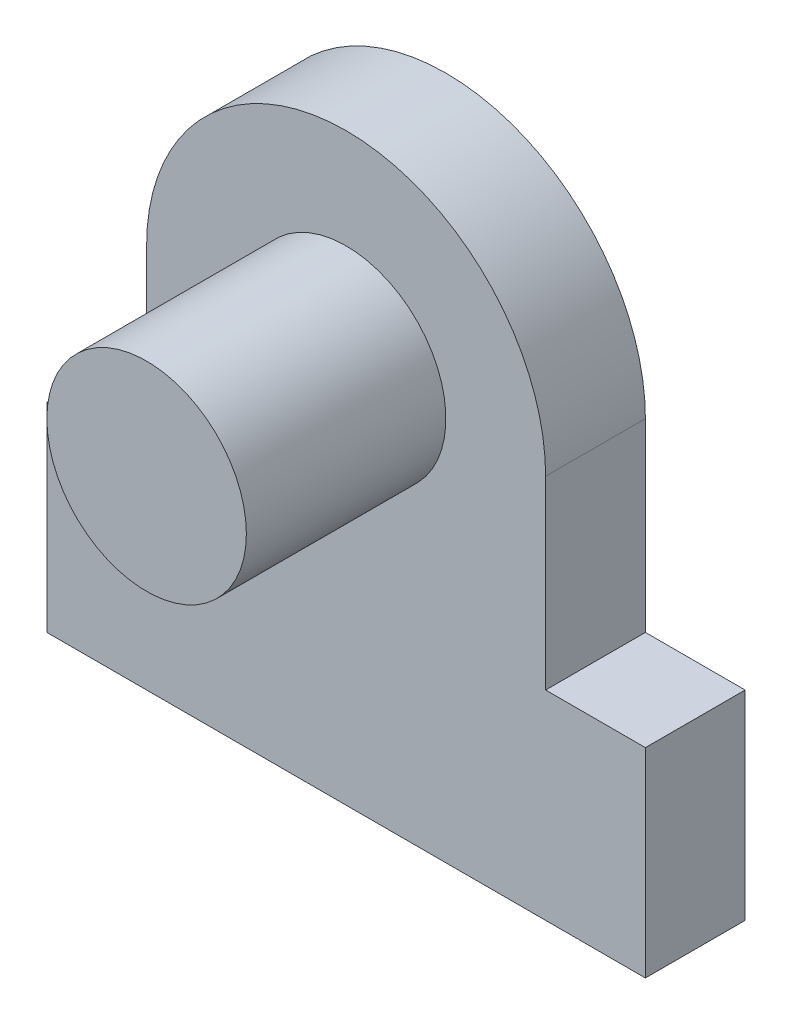
from build123d import *

# Parameters (mm, degrees)
BOSS_EXTRUDE1_DEPTH = 10
SKETCH3_R           = 10
BOSS_EXTRUDE2_DEPTH = 20


with BuildPart() as part:
    # Sketch2 → Boss-Extrude1 (new body)
    with BuildSketch(Plane.XY):
        with BuildLine():
            Line((0, 0), (10, 0))
            Line((10, 0), (10, 18.56))
            ThreePointArc((10, 18.56), (30, 38.56), (50, 18.56))
            Line((50, 18.56), (50, 0))
            Line((50, 0), (60, 0))
            Line((60, 0), (60, -20))
            Line((60, -20), (0, -20))
            Line((0, -20), (0, 0))
        make_face()
    extrude(amount=BOSS_EXTRUDE1_DEPTH)

    # Sketch3 → Boss-Extrude2 (add)
    with BuildSketch(Plane.XY.offset(10)):
        with Locations(Location((30, 18.56, 0), (0, 0, 180))):
            Circle(SKETCH3_R)
    extrude(amount=BOSS_EXTRUDE2_DEPTH)


solid = part.part
